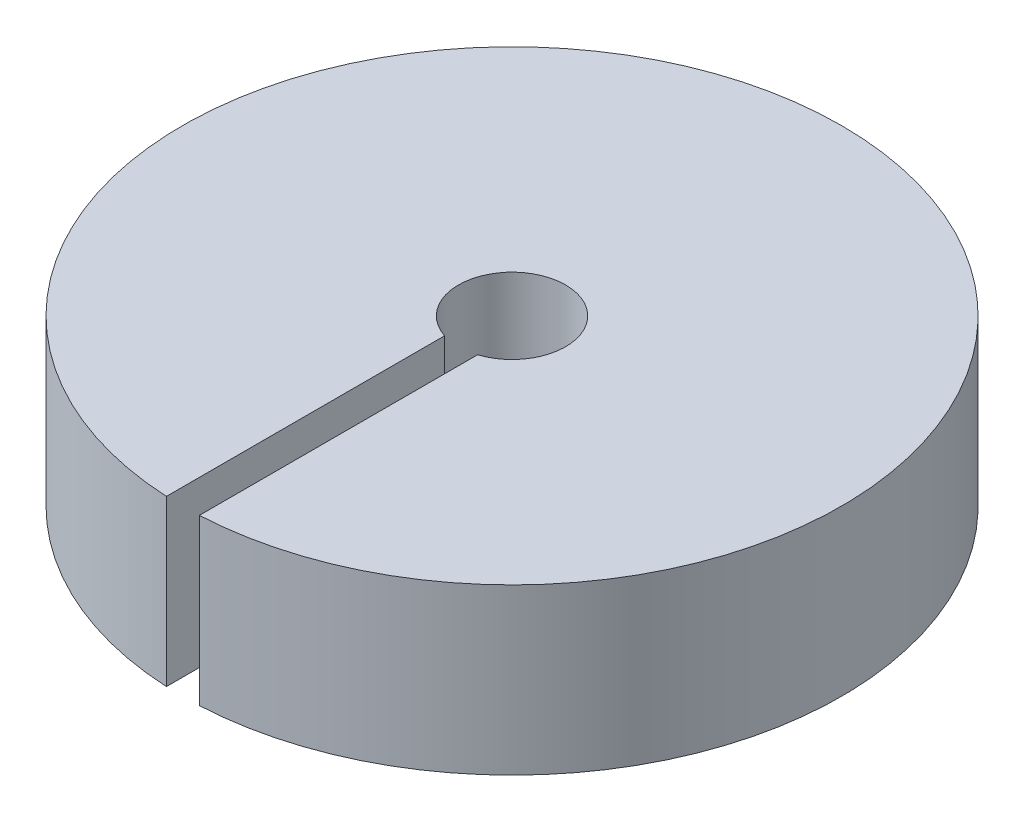
from build123d import *

# Parameters (mm, degrees)
BOSS_EXTRUDE1_DEPTH = 10


with BuildPart() as part:
    # Sketch1 → Boss-Extrude1 (new body)
    with BuildSketch(Plane(origin=(0, 0, 0), x_dir=(1, 0, 0), z_dir=(0, 1, 0))):
        with BuildLine():
            Line((-1, -3.092329219), (-1, -19.974984355))
            ThreePointArc((-1, -19.974984355), (0, 20), (1, -19.974984355))
            Line((1, -19.974984355), (1, -3.092329219))
            ThreePointArc((1, -3.092329219), (0, 3.25), (-1, -3.092329219))
        make_face()
    extrude(amount=BOSS_EXTRUDE1_DEPTH)


solid = part.part
